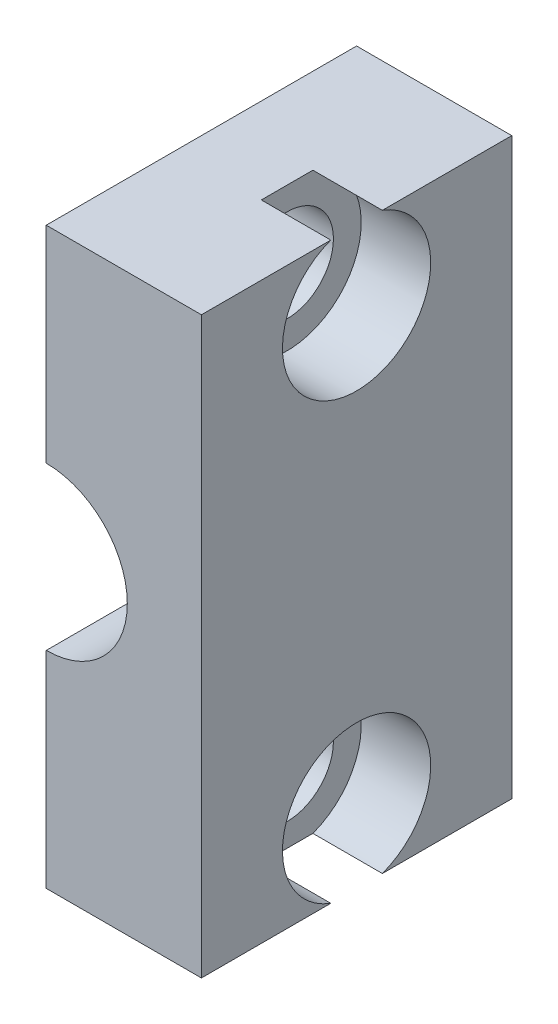
from build123d import *

# Parameters (mm, degrees)
EXTRUDE_1_DEPTH     = 2.7
SKETCH_1_4_W        = 3.35
SKETCH_1_4_H        = 12.4
EXTRUDE_2_DEPTH     = 2
EXTRUDE_START       = 2.7
SKETCH_1_5_W        = 3.35
SKETCH_1_5_H        = 12.4
EXTRUDE_3_DEPTH     = 2
SKETCH_2_R          = 1.75
CUT_EXTRUDE_1_DEPTH = 10.723810981
SKETCH_4_R          = 1
CUT_EXTRUDE_2_DEPTH = 9.470684742
SKETCH_4_3_R        = 1.6
SKETCH_4_3_R_2      = 1
CUT_EXTRUDE_3_DEPTH = 1.5


with BuildPart() as part:
    # 草图1 → 凸台-拉伸1 (new body)
    with BuildSketch(Plane.XY):
        with BuildLine():
            Line((3.35, 6.2), (0, 6.2))
            Line((0, 6.2), (0, 3.2))
            ThreePointArc((0, 3.2), (2.2627417, 2.2627417), (3.2, 0))
            ThreePointArc((3.2, 0), (2.2627417, -2.2627417), (0, -3.2))
            Line((0, -3.2), (0, -6.2))
            Line((0, -6.2), (3.35, -6.2))
            Line((3.35, -6.2), (3.35, 6.2))
        make_face()
    extrude(amount=EXTRUDE_1_DEPTH)

    # 草图1<4> → 凸台-拉伸2 (add)
    with BuildSketch(Plane.XY):
        with Locations((1.675, 0)):
            Rectangle(SKETCH_1_4_W, SKETCH_1_4_H)
    extrude(amount=-EXTRUDE_2_DEPTH)

    # 草图1<5> → 凸台-拉伸3 (add)
    with BuildSketch(Plane.XY.offset(EXTRUDE_START)):
        with Locations((1.675, 0)):
            Rectangle(SKETCH_1_5_W, SKETCH_1_5_H)
    extrude(amount=EXTRUDE_3_DEPTH)

    # 草图2 → 切除-拉伸1 (cut, through all)
    with BuildSketch(Plane.XY.offset(4.7)):
        Circle(SKETCH_2_R)
    extrude(amount=-CUT_EXTRUDE_1_DEPTH, mode=Mode.SUBTRACT)

    # 草图4 → 切除-拉伸2 (cut, through all)
    with BuildSketch(Plane(origin=(3.35, 0, 0), x_dir=(0, 0, -1), z_dir=(1, 0, 0))):
        with Locations((-1.35, -4.7)):
            Circle(SKETCH_4_R)
        with Locations((-1.35, 4.7)):
            Circle(SKETCH_4_R)
    extrude(amount=-CUT_EXTRUDE_2_DEPTH, mode=Mode.SUBTRACT)

    # 草图4<3> → 切除-拉伸3 (cut)
    # profile 1 of 2: a face of its own
    with BuildSketch(Plane(origin=(3.35, 0, 0), x_dir=(0, 0, -1), z_dir=(1, 0, 0))):
        with Locations((-1.35, 4.7)):
            Circle(SKETCH_4_3_R)
        with Locations((-1.35, 4.7)):
            Circle(SKETCH_4_3_R_2, mode=Mode.SUBTRACT)
    # profile 2 of 2: a face of its own
    with BuildSketch(Plane(origin=(3.35, 0, 0), x_dir=(0, 0, -1), z_dir=(1, 0, 0))):
        with Locations((-1.35, -4.7)):
            Circle(SKETCH_4_3_R)
        with Locations((-1.35, -4.7)):
            Circle(SKETCH_4_3_R_2, mode=Mode.SUBTRACT)
    extrude(amount=-CUT_EXTRUDE_3_DEPTH, mode=Mode.SUBTRACT)


solid = part.part
